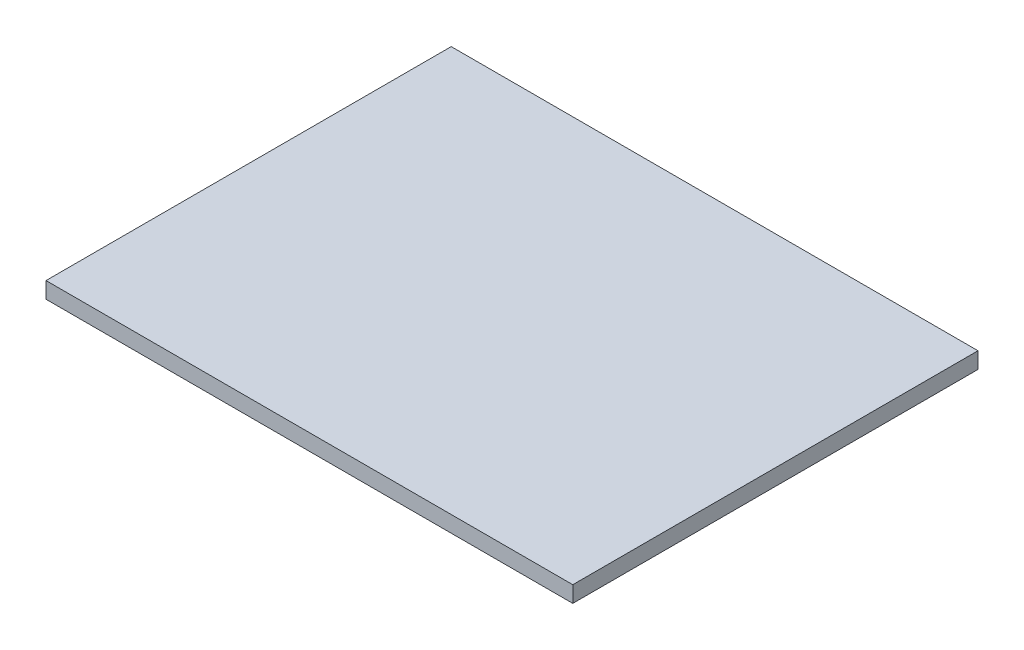
from build123d import *

# Parameters (mm, degrees)
SKETCH1_W           = 325
SKETCH1_H           = 250
BOSS_EXTRUDE1_DEPTH = 10


with BuildPart() as part:
    # Sketch1 → Boss-Extrude1 (new body)
    with BuildSketch(Plane(origin=(0, 0, 0), x_dir=(1, 0, 0), z_dir=(0, 1, 0))):
        Rectangle(SKETCH1_W, SKETCH1_H)
    extrude(amount=BOSS_EXTRUDE1_DEPTH)


solid = part.part
